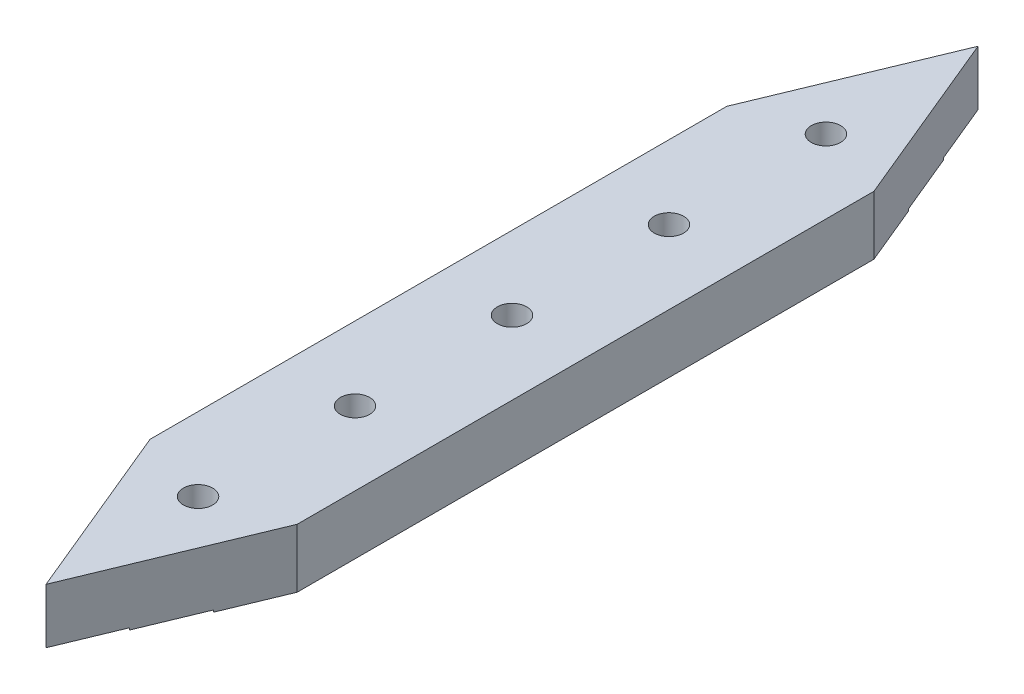
from build123d import *

# Parameters (mm, degrees)
BOSS_EXTRUDE1_DEPTH    = 7.62
SKETCH2_W              = 12.7
SKETCH2_H              = 120.65
CUT_EXTRUDE1_DEPTH     = 0.254
SKETCH3_W              = 6.35
SKETCH3_H              = 120.65
CUT_EXTRUDE2_DEPTH     = 0.254
F_10_24_TAPPED_HOLE1_D = 3.7973


with BuildPart() as part:
    # Sketch1 → Boss-Extrude1 (new body)
    with BuildSketch(Plane(origin=(0, 0, 0), x_dir=(1, 0, 0), z_dir=(0, 1, 0))):
        Polygon((0, 60.325), (-9.525, 37.329615818), (-9.525, -37.329615818), (0, -60.325), (9.525, -37.329615818), (9.525, 37.329615818), align=None)
    extrude(amount=BOSS_EXTRUDE1_DEPTH)

    # Sketch2 → Cut-Extrude1 (cut)
    with BuildSketch(Plane.XZ):
        Rectangle(SKETCH2_W, SKETCH2_H)
    extrude(amount=-CUT_EXTRUDE1_DEPTH, mode=Mode.SUBTRACT)

    # Sketch3 → Cut-Extrude2 (cut)
    with BuildSketch(Plane.XZ.offset(-0.254)):
        Rectangle(SKETCH3_W, SKETCH3_H)
    extrude(amount=-CUT_EXTRUDE2_DEPTH, mode=Mode.SUBTRACT)

    # #10-24 Tapped Hole1 (through all)
    with Locations(Plane(origin=(0, 7.62, 0), x_dir=(1, 0, 0), z_dir=(0, 1, 0))):
        with Locations((0, 20.32), (0, 40.64), (0, 0), (0, -20.32), (0, -40.64)):
            Hole(F_10_24_TAPPED_HOLE1_D / 2)


solid = part.part
